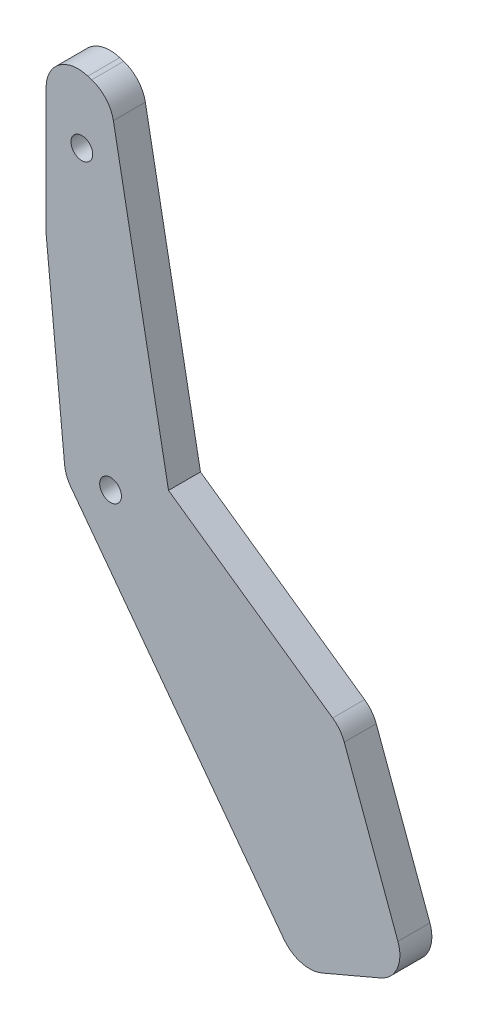
from build123d import *

# Parameters (mm, degrees)
SKETCH1_R           = 1.7
BOSS_EXTRUDE1_DEPTH = 5


with BuildPart() as part:
    # Sketch1 → Boss-Extrude1 (new body)
    with BuildSketch(Plane.XY):
        with BuildLine():
            Line((9.571131615, 22.290661788), (12.45890696, -7.549683437))
            ThreePointArc((12.45890696, -7.549683437), (12.772506188, -8.872231039), (13.430707906, -10.06145227))
            Line((13.430707906, -10.06145227), (46.762768529, -54.65745062))
            ThreePointArc((46.762768529, -54.65745062), (49.46823245, -56.492242481), (52.729148127, -56.263277104))
            Line((52.729148127, -56.263277104), (61.868035374, -52.365810483))
            ThreePointArc((61.868035374, -52.365810483), (64.497484035, -49.747459847), (64.598320481, -46.038067399))
            Line((64.598320481, -46.038067399), (56.204499393, -23.254838732))
            ThreePointArc((56.204499393, -23.254838732), (55.474314099, -21.932746284), (54.382663092, -20.889004416))
            Line((54.382663092, -20.889004416), (28.713394846, -2.896526673))
            Line((28.713394846, -2.896526673), (20.09267624, 42.882461783))
            ThreePointArc((20.09267624, 42.882461783), (18.924854223, 45.269094952), (16.699240102, 46.720462558))
            Line((16.699240102, 46.720462558), (16.091332484, 46.914475628))
            ThreePointArc((16.091332484, 46.914475628), (11.621640502, 46.18856761), (9.571131615, 42.151179571))
            Line((9.571131615, 42.151179571), (9.571131615, 22.290661788))
        make_face()
        with Locations((15.155921835, 36.698515682)):
            Circle(SKETCH1_R, mode=Mode.SUBTRACT)
        with Locations((19.648657186, -7.364112555)):
            Circle(SKETCH1_R, mode=Mode.SUBTRACT)
    extrude(amount=BOSS_EXTRUDE1_DEPTH)


solid = part.part
